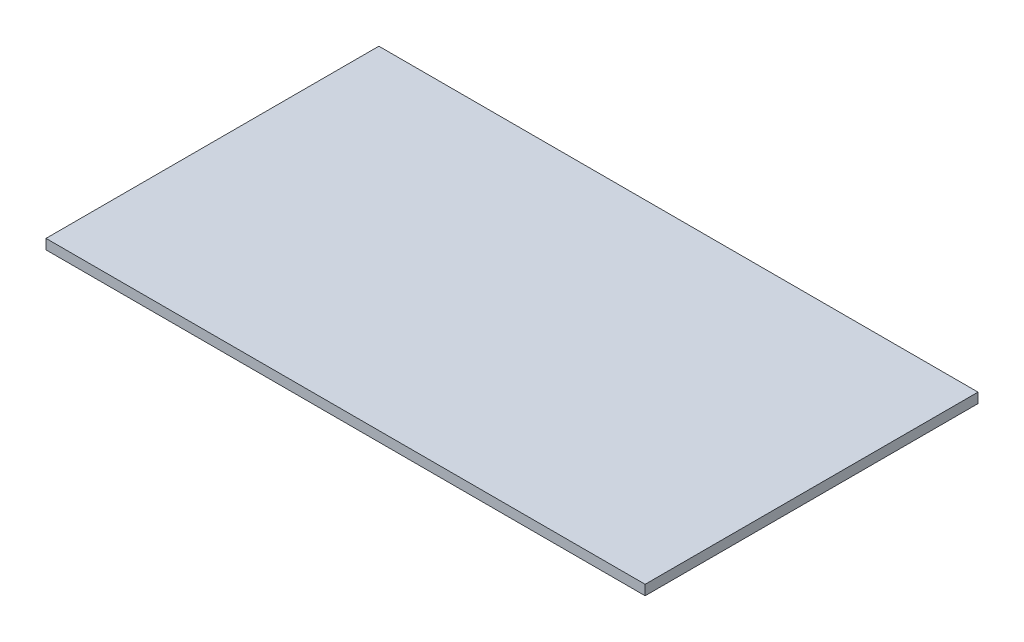
from build123d import *

# Parameters (mm, degrees)
SKETCH1_W           = 90
SKETCH1_H           = 50
BOSS_EXTRUDE1_DEPTH = 1.5


with BuildPart() as part:
    # Sketch1 → Boss-Extrude1 (new body)
    with BuildSketch(Plane(origin=(0, 0, 0), x_dir=(1, 0, 0), z_dir=(0, 1, 0))):
        with Locations((45, 25)):
            Rectangle(SKETCH1_W, SKETCH1_H)
    extrude(amount=BOSS_EXTRUDE1_DEPTH)


solid = part.part
